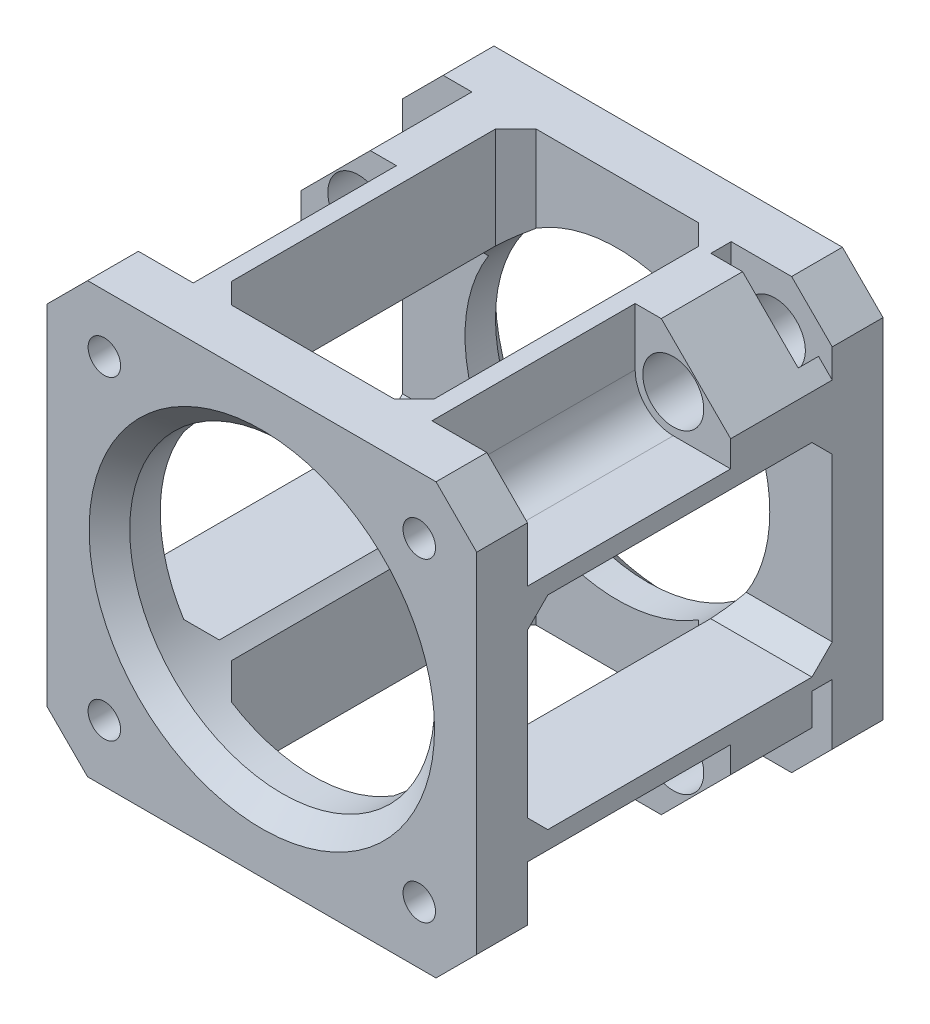
from build123d import *

# Parameters (mm, degrees)
SKETCH1_W           = 42.3
SKETCH1_H           = 42.3
SKETCH1_R           = 1.6
BOSS_EXTRUDE1_DEPTH = 40
SKETCH2_R           = 15
CUT_EXTRUDE1_DEPTH  = 40
CHAMFER1_SIZE       = 4
CHAMFER2_SIZE       = 2
SKETCH3_W           = 30
SKETCH3_H           = 20
CUT_EXTRUDE2_DEPTH  = 72.962351268
SKETCH4_W           = 20
SKETCH4_H           = 30
CUT_EXTRUDE3_DEPTH  = 72.962351268
CHAMFER3_SIZE       = 2
SKETCH5_W           = 30
SKETCH5_H           = 15
CUT_EXTRUDE5_DEPTH  = 2
CIRPATTERN1_COUNT   = 4
CUT_EXTRUDE6_DEPTH  = 2
CIRPATTERN2_COUNT   = 4
CUT_EXTRUDE7_DEPTH  = 20
CIRPATTERN3_COUNT   = 4
SKETCH10_R          = 3
CUT_EXTRUDE8_DEPTH  = 20


with BuildPart() as part:
    # Sketch1 → Boss-Extrude1 (new body)
    with BuildSketch(Plane.XY):
        with Locations((21.15, 21.15)):
            Rectangle(SKETCH1_W, SKETCH1_H)
        with Locations((5.65, 36.65)):
            Circle(SKETCH1_R, mode=Mode.SUBTRACT)
        with Locations((5.65, 5.65)):
            Circle(SKETCH1_R, mode=Mode.SUBTRACT)
        with Locations((36.65, 5.65)):
            Circle(SKETCH1_R, mode=Mode.SUBTRACT)
        with Locations((36.65, 36.65)):
            Circle(SKETCH1_R, mode=Mode.SUBTRACT)
    extrude(amount=BOSS_EXTRUDE1_DEPTH)

    # Sketch2 → Cut-Extrude1 (cut)
    with BuildSketch(Plane.XY.offset(40)):
        with Locations((21.15, 21.15)):
            Circle(SKETCH2_R)
    extrude(amount=-CUT_EXTRUDE1_DEPTH, mode=Mode.SUBTRACT)

    # Chamfer1
    chamfer1_edges = [part.edges().sort_by_distance(p)[0] for p in [
        (0, 0, 20),
        (0, 42.3, 20),
        (42.3, 42.3, 20),
        (42.3, 0, 20),
    ]]
    chamfer(chamfer1_edges, length=CHAMFER1_SIZE)

    # Chamfer2
    chamfer2_edges = [part.edges().sort_by_distance(p)[0] for p in [
        (6.15, 21.15, 0),
        (6.15, 21.15, 40),
    ]]
    chamfer(chamfer2_edges, length=CHAMFER2_SIZE)

    # Sketch3 → Cut-Extrude2 (cut, through all)
    with BuildSketch(Plane(origin=(42.3, 0, 0), x_dir=(0, 0, -1), z_dir=(1, 0, 0))):
        with Locations((-20, 21.15)):
            Rectangle(SKETCH3_W, SKETCH3_H)
    extrude(amount=-CUT_EXTRUDE2_DEPTH, mode=Mode.SUBTRACT)

    # Sketch4 → Cut-Extrude3 (cut, through all)
    with BuildSketch(Plane(origin=(0, 42.3, 0), x_dir=(1, 0, 0), z_dir=(0, 1, 0))):
        with Locations((21.15, -20)):
            Rectangle(SKETCH4_W, SKETCH4_H)
    extrude(amount=-CUT_EXTRUDE3_DEPTH, mode=Mode.SUBTRACT)

    # Chamfer3
    chamfer3_edges = [part.edges().sort_by_distance(p)[0] for p in [
        (31.15, 37.315169944, 5),
        (31.15, 4.984830056, 5),
        (31.15, 4.984830056, 35),
        (31.15, 37.315169944, 35),
        (11.15, 4.984830056, 35),
        (11.15, 37.315169944, 35),
        (11.15, 4.984830056, 5),
        (11.15, 37.315169944, 5),
        (4.984830056, 31.15, 5),
        (37.315169944, 31.15, 5),
        (37.315169944, 11.15, 5),
        (4.984830056, 11.15, 5),
        (4.984830056, 11.15, 35),
        (37.315169944, 11.15, 35),
        (4.984830056, 31.15, 35),
        (37.315169944, 31.15, 35),
    ]]
    chamfer(chamfer3_edges, length=CHAMFER3_SIZE)

    # Sketch5 → Cut-Extrude5 (cut)
    with BuildSketch(Plane(origin=(-19.15, 19.15, 0), x_dir=(0, 0, 1), z_dir=(-0.7071067811865469, 0.7071067811865481, 0))):
        with Locations((20, 29.910616844)):
            Rectangle(SKETCH5_W, SKETCH5_H)
    cut_extrude5 = extrude(amount=-CUT_EXTRUDE5_DEPTH, mode=Mode.SUBTRACT)

    # CirPattern1: Cut-Extrude5 ×4 about axis
    cirpattern1_axis = Axis((21.15, 21.15, 0), (0, 0, 1))
    for i in range(1, CIRPATTERN1_COUNT):
        add(cut_extrude5.rotate(cirpattern1_axis, i * 360 / CIRPATTERN1_COUNT), mode=Mode.SUBTRACT)

    # Sketch8 → Cut-Extrude6 (cut)
    with BuildSketch(Plane.XY.offset(5)):
        Polygon((36.821572875, 40.95), (32.35, 40.95), (32.35, 32.35), (40.95, 32.35), (40.95, 36.821572875), align=None)
        Polygon((35.471572875, 42.3), (36.821572875, 40.95), (39.65, 40.95), (38.3, 42.3), align=None)
        Polygon((32.35, 42.3), (32.35, 40.95), (36.821572875, 40.95), (35.471572875, 42.3), align=None)
        Polygon((39.65, 40.95), (36.821572875, 40.95), (40.95, 36.821572875), (40.95, 39.65), align=None)
        Polygon((38.3, 42.3), (39.65, 40.95), (40.95, 40.95), (40.95, 42.3), align=None)
    cut_extrude6 = extrude(amount=CUT_EXTRUDE6_DEPTH, mode=Mode.SUBTRACT)

    # CirPattern2: Cut-Extrude6 ×4 about axis
    cirpattern2_axis = Axis((21.15, 21.15, 0), (0, 0, 1))
    for i in range(1, CIRPATTERN2_COUNT):
        add(cut_extrude6.rotate(cirpattern2_axis, i * 360 / CIRPATTERN2_COUNT), mode=Mode.SUBTRACT)

    # Sketch9 → Cut-Extrude7 (cut)
    with BuildSketch(Plane(origin=(0, 0, 35), x_dir=(-1, 0, 0), z_dir=(0, 0, -1))):
        with BuildLine():
            Line((-36.65, 32.9), (-42.3, 32.9))
            Line((-42.3, 32.9), (-42.3, 38.3))
            Line((-42.3, 38.3), (-38.3, 42.3))
            Line((-38.3, 42.3), (-32.9, 42.3))
            Line((-32.9, 42.3), (-32.9, 36.65))
            ThreePointArc((-32.9, 36.65), (-33.998349571, 33.998349571), (-36.65, 32.9))
        make_face()
    cut_extrude7 = extrude(amount=CUT_EXTRUDE7_DEPTH, mode=Mode.SUBTRACT)

    # CirPattern3: Cut-Extrude7 ×4 about axis
    cirpattern3_axis = Axis((21.15, 21.15, 0), (0, 0, 1))
    for i in range(1, CIRPATTERN3_COUNT):
        add(cut_extrude7.rotate(cirpattern3_axis, i * 360 / CIRPATTERN3_COUNT), mode=Mode.SUBTRACT)

    # Sketch10 → Cut-Extrude8 (cut)
    with BuildSketch(Plane(origin=(0, 0, 0), x_dir=(-1, 0, 0), z_dir=(0, 0, -1))):
        with Locations((-36.65, 36.65)):
            Circle(SKETCH10_R)
        with Locations((-5.65, 36.65)):
            Circle(SKETCH10_R)
        with Locations((-5.65, 5.65)):
            Circle(SKETCH10_R)
        with Locations((-36.65, 5.65)):
            Circle(SKETCH10_R)
    extrude(amount=-CUT_EXTRUDE8_DEPTH, mode=Mode.SUBTRACT)


solid = part.part
